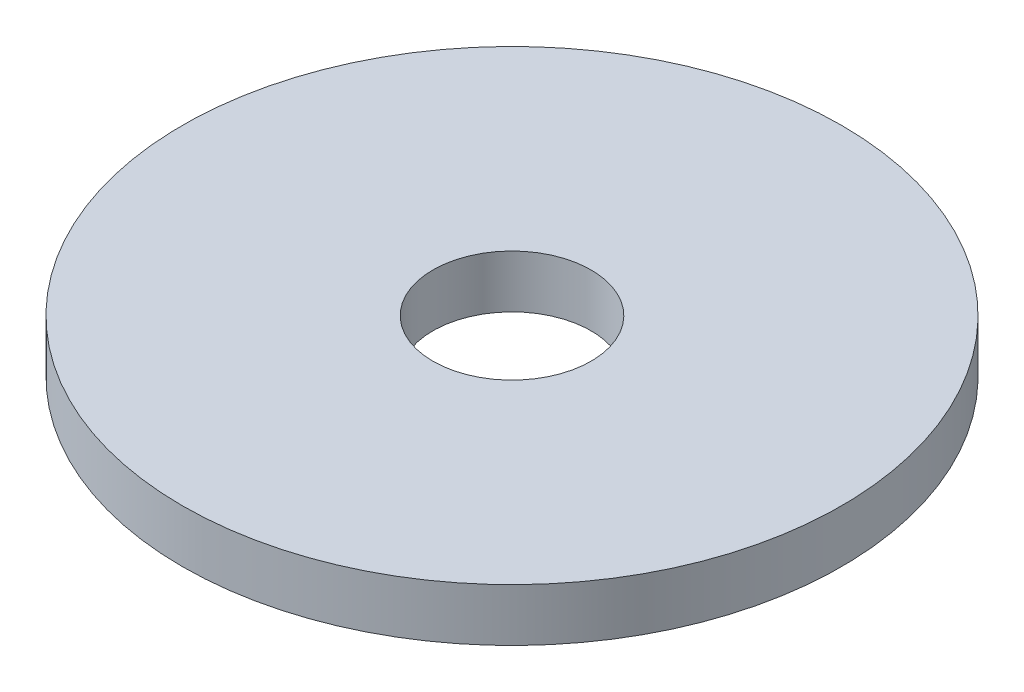
from build123d import *

# Parameters (mm, degrees)
SKETCH1_R           = 6.25
SKETCH1_R_2         = 1.5
BOSS_EXTRUDE1_DEPTH = 1


with BuildPart() as part:
    # Sketch1 → Boss-Extrude1 (new body)
    with BuildSketch(Plane(origin=(0, 0, 0), x_dir=(1, 0, 0), z_dir=(0, 1, 0))):
        with Locations(Location((0, 0, 0), (0, 0, 270))):
            Circle(SKETCH1_R)
        with Locations(Location((0, 0, 0), (0, 0, 270))):
            Circle(SKETCH1_R_2, mode=Mode.SUBTRACT)
    extrude(amount=BOSS_EXTRUDE1_DEPTH)


solid = part.part
